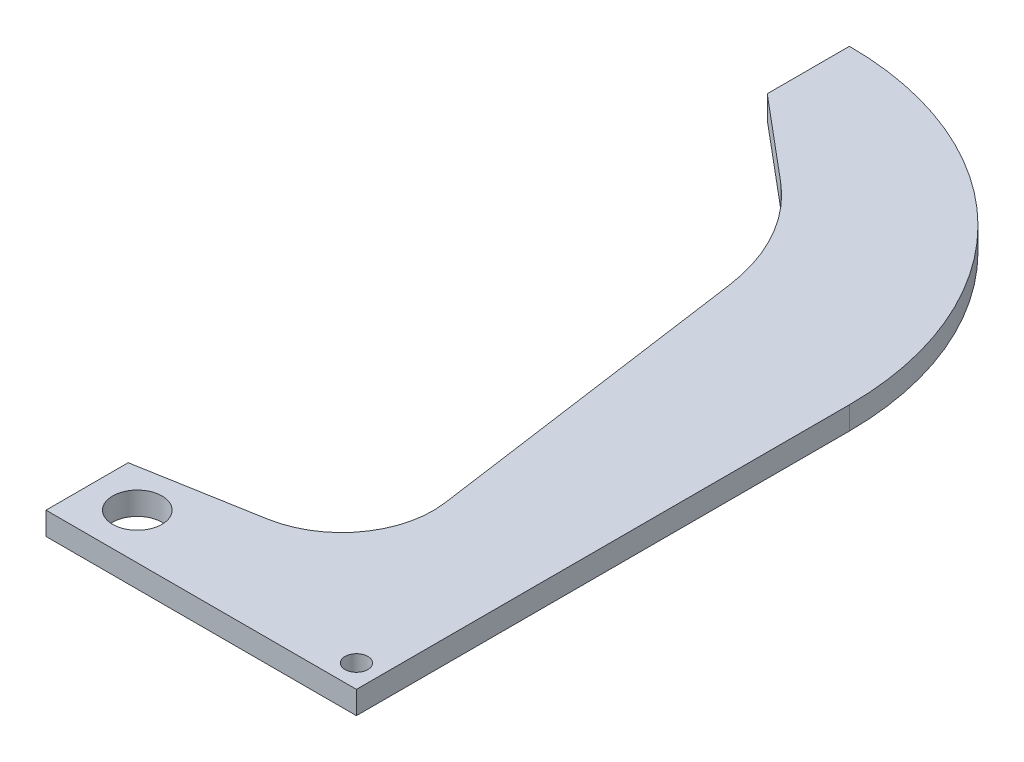
from build123d import *

# Parameters (mm, degrees)
SKETCH1_R           = 3.429
SKETCH1_R_2         = 1.5875
BOSS_EXTRUDE1_DEPTH = 3.175
CUT_EXTRUDE1_DEPTH  = 120.85362166


with BuildPart() as part:
    # Sketch1 → Boss-Extrude1 (new body)
    with BuildSketch(Plane(origin=(0, 0, 0), x_dir=(1, 0, 0), z_dir=(0, 1, 0))):
        with BuildLine():
            Line((0, 0), (43.18, 0))
            Line((43.18, 0), (43.18, 68.58))
            ThreePointArc((43.18, 68.58), (30.532870812, 99.112870812), (0, 111.76))
            Line((0, 111.76), (0, 0))
        make_face()
        with Locations(Location((6.35, 6.35, 0), (0, 0, 270))):
            Circle(SKETCH1_R, mode=Mode.SUBTRACT)
        with Locations(Location((40.005, 3.175, 0), (0, 0, 270))):
            Circle(SKETCH1_R_2, mode=Mode.SUBTRACT)
    extrude(amount=BOSS_EXTRUDE1_DEPTH)

    # Sketch2 → Cut-Extrude1 (cut, through all)
    with BuildSketch(Plane(origin=(0, 3.175, 0), x_dir=(1, 0, 0), z_dir=(0, 1, 0))):
        with BuildLine():
            Line((16.499594236, 14.339323634), (0, 11.43))
            Line((0, 11.43), (0, 100.33))
            Line((0, 100.33), (11.578626407, 90.614378852))
            ThreePointArc((11.578626407, 90.614378852), (17.468445655, 83.468697719), (20.405366763, 74.686600928))
            Line((20.405366763, 74.686600928), (26.8710352, 28.611257563))
            ThreePointArc((26.8710352, 28.611257563), (24.567999732, 19.380438031), (16.499594236, 14.339323634))
        make_face()
    extrude(amount=-CUT_EXTRUDE1_DEPTH, mode=Mode.SUBTRACT)


solid = part.part
